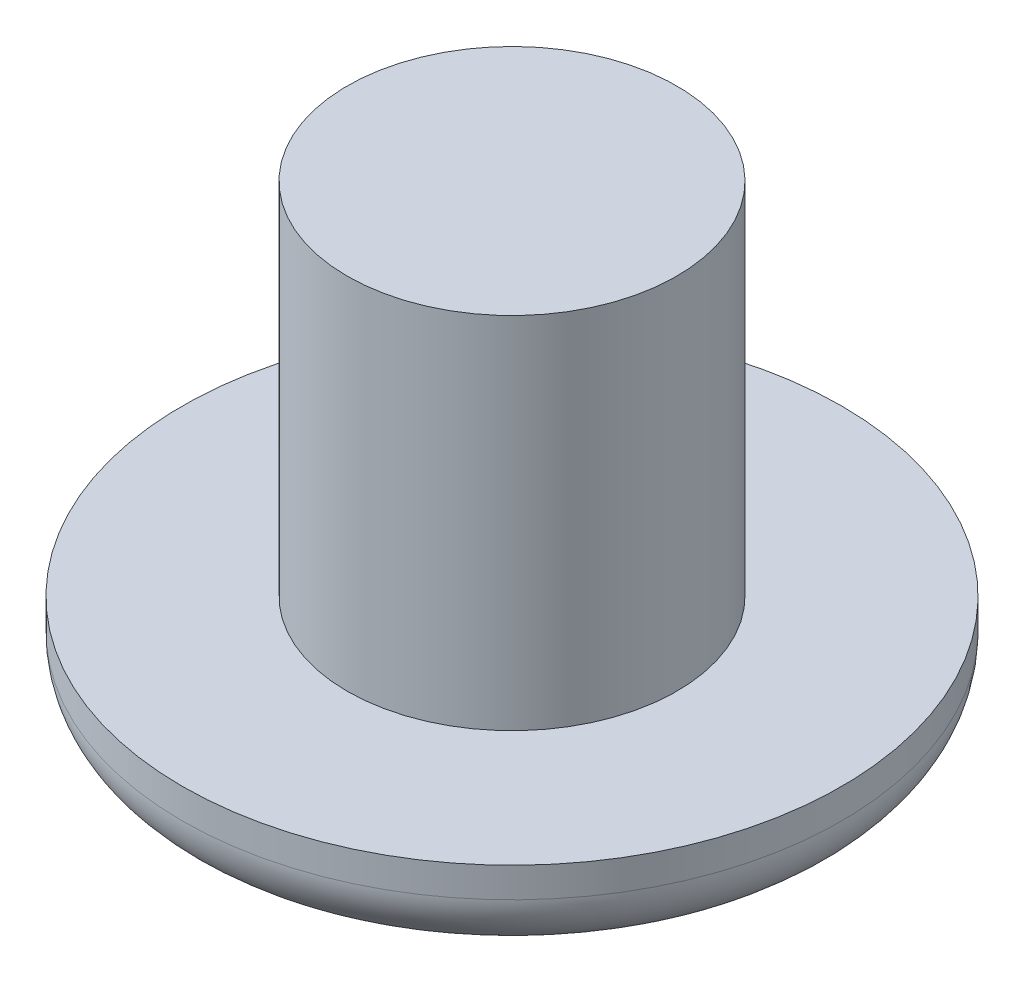
from build123d import *

# Parameters (mm, degrees)
SKETCH1_R           = 5.5
BOSS_EXTRUDE1_DEPTH = 12
SKETCH1_3_R         = 11
BOSS_EXTRUDE2_DEPTH = 3
FILLET1_R           = 2


with BuildPart() as part:
    # Sketch1 → Boss-Extrude1 (new body)
    with BuildSketch(Plane(origin=(0, 0, 0), x_dir=(1, 0, 0), z_dir=(0, 1, 0))):
        Circle(SKETCH1_R)
    extrude(amount=BOSS_EXTRUDE1_DEPTH)

    # Sketch1<3> → Boss-Extrude2 (add)
    with BuildSketch(Plane(origin=(0, 0, 0), x_dir=(1, 0, 0), z_dir=(0, 1, 0))):
        Circle(SKETCH1_3_R)
    extrude(amount=-BOSS_EXTRUDE2_DEPTH)

    # Fillet1
    fillet1_edges = [part.edges().sort_by_distance(p)[0] for p in [
        (-11, -3, 0),
    ]]
    fillet(fillet1_edges, radius=FILLET1_R)


solid = part.part
